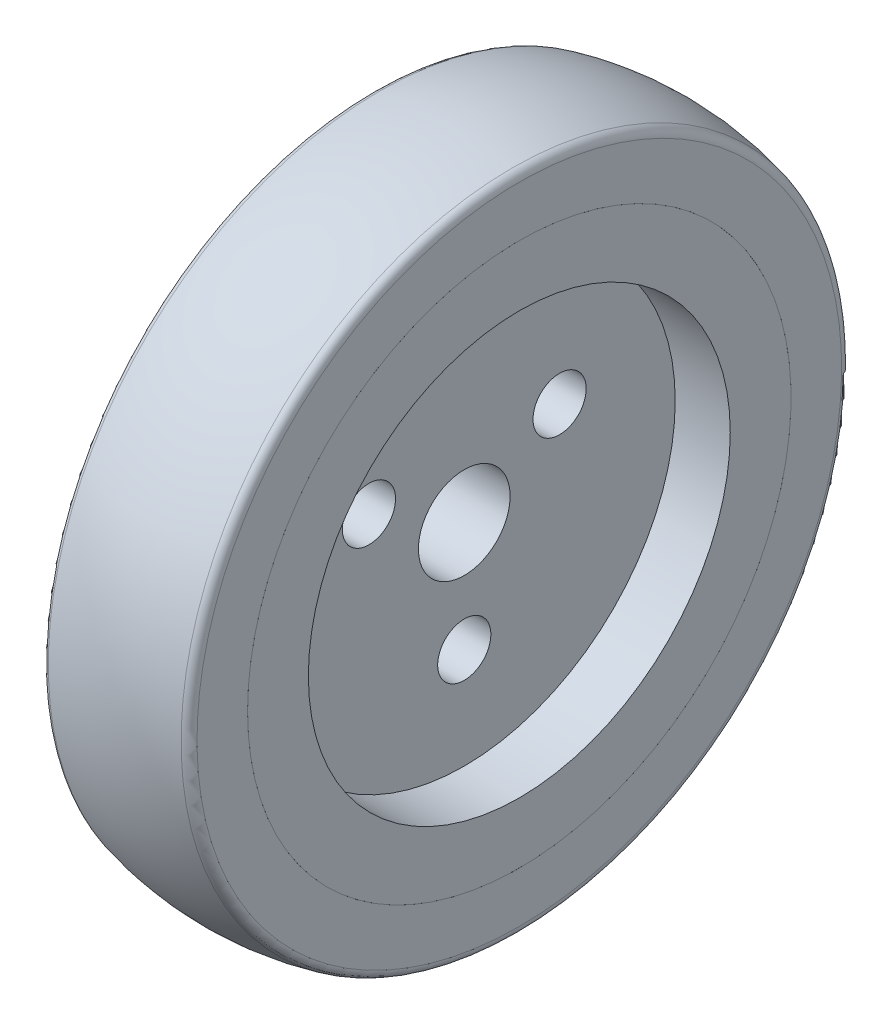
from build123d import *
from build123d.topology import SkipClean

# Parameters (mm, degrees)
CONG_1_R                     = 0.5
ESQUISSE4_W                  = 0.5
ESQUISSE4_H                  = 9
ESQUISSE6_W                  = 3
ESQUISSE6_H                  = 11.5
ESQUISSE8_W                  = 1.45
ESQUISSE8_H                  = 5.5
R_P_TITION_CIRCULAIRE1_COUNT = 3


with BuildPart() as part:
    # Esquisse2 → Révolution1 (revolve)
    with BuildSketch(Plane.XY, mode=Mode.PRIVATE) as r_volution1_sk:
        with BuildLine():
            Line((4, 2.5), (-4, 2.5))
            Line((-4, 2.5), (-4, 17.956832295))
            ThreePointArc((-4, 17.956832295), (0, 18.5), (4, 17.956832295))
            Line((4, 17.956832295), (4, 2.5))
        make_face()
    revolve(r_volution1_sk.sketch.rotate(Axis((-12.5, 0, 0), (1, 0, 0)), 180), axis=Axis((-12.5, 0, 0), (1, 0, 0)))

    # Esquisse3 → Enlèvement de matière-Révolution1 (revolve, cut)
    with BuildSketch(Plane.XY, mode=Mode.PRIVATE) as enl_vement_de_mati_re_r_volution1_sk:
        with BuildLine():
            Line((-4, 14.813708499), (-4, 14.812647833))
            ThreePointArc((-4, 14.812647833), (0, 15.499), (4, 14.812647833))
            Line((4, 14.812647833), (4, 14.813708499))
            ThreePointArc((4, 14.813708499), (0, 15.5), (-4, 14.813708499))
        make_face()
    revolve(enl_vement_de_mati_re_r_volution1_sk.sketch.rotate(Axis((-4, 0, 0), (1, 0, 0)), 90), axis=Axis((-4, 0, 0), (1, 0, 0)), mode=Mode.SUBTRACT)


with BuildPart() as enl_vement_de_mati_re_r_volution1_piece:
    # of the separate pieces the step leaves, piece 1, a body of its own (enl_vement_de_mati_re_r_volution1_pieces)
    add(part.part.solids().sort_by_distance((4, 0, 14.812647833))[0])

    # Esquisse4 → Révolution2 (revolve)
    with SkipClean():  # the faces are left unmerged after this step: merging them gives an invalid solid
        with BuildSketch(Plane.XY, mode=Mode.PRIVATE) as r_volution2_sk:
            with Locations((-4.25, 7)):
                Rectangle(ESQUISSE4_W, ESQUISSE4_H)
        revolve(r_volution2_sk.sketch.rotate(Axis((4, 0, 0), (-1, 0, 0)), 270), axis=Axis((4, 0, 0), (-1, 0, 0)))

    # Esquisse6 → Enlèvement de matière-Révolution2 (revolve, cut)
    with SkipClean():  # the faces are left unmerged after this step: merging them gives an invalid solid
        with BuildSketch(Plane.XY, mode=Mode.PRIVATE) as enl_vement_de_mati_re_r_volution2_sk:
            with Locations((2.5, 5.75)):
                Rectangle(ESQUISSE6_W, ESQUISSE6_H)
        revolve(enl_vement_de_mati_re_r_volution2_sk.sketch.rotate(Axis((1, 0, 0), (1, 0, 0)), 90), axis=Axis((1, 0, 0), (1, 0, 0)), mode=Mode.SUBTRACT)

    # Esquisse8 → Diamètre du perçage Ø3.5 (3.5)1 (revolve, cut)
    with SkipClean():  # the faces are left unmerged after this step: merging them gives an invalid solid
        with BuildSketch(Plane(origin=(1, -6, 0), x_dir=(0, 0, -1), z_dir=(0, 1, 0))):
            with Locations((0.725, 2.75)):
                Rectangle(ESQUISSE8_W, ESQUISSE8_H)
        diam_tre_du_per_age_3_5_3_5_1 = revolve(axis=Axis((7.35, -6, 0), (-1, 0, 0)), mode=Mode.SUBTRACT)

    # Répétition circulaire1: Diamètre du perçage Ø3.5 (3.5)1 ×3 about axis
    with SkipClean():  # the faces are left unmerged after this step: merging them gives an invalid solid
        r_p_tition_circulaire1_axis = Axis((0, 0, 0), (1, 0, 0))
        for i in range(1, R_P_TITION_CIRCULAIRE1_COUNT):
            add(diam_tre_du_per_age_3_5_3_5_1.rotate(r_p_tition_circulaire1_axis, i * 360 / R_P_TITION_CIRCULAIRE1_COUNT), mode=Mode.SUBTRACT)


with BuildPart() as enl_vement_de_mati_re_r_volution1_pi_2:
    # of the separate pieces the step leaves, piece 2, a body of its own (enl_vement_de_mati_re_r_volution1_pieces)
    add(part.part.solids().sort_by_distance((4, -17.956832295, 0))[0])

    # Congé1
    cong_1_edges = [enl_vement_de_mati_re_r_volution1_pi_2.edges().sort_by_distance(p)[0] for p in [
        (-4, 17.956832295, 0),
        (4, 17.956832295, 0),
    ]]
    fillet(cong_1_edges, radius=CONG_1_R)


solid = Compound([enl_vement_de_mati_re_r_volution1_piece.part, enl_vement_de_mati_re_r_volution1_pi_2.part])
